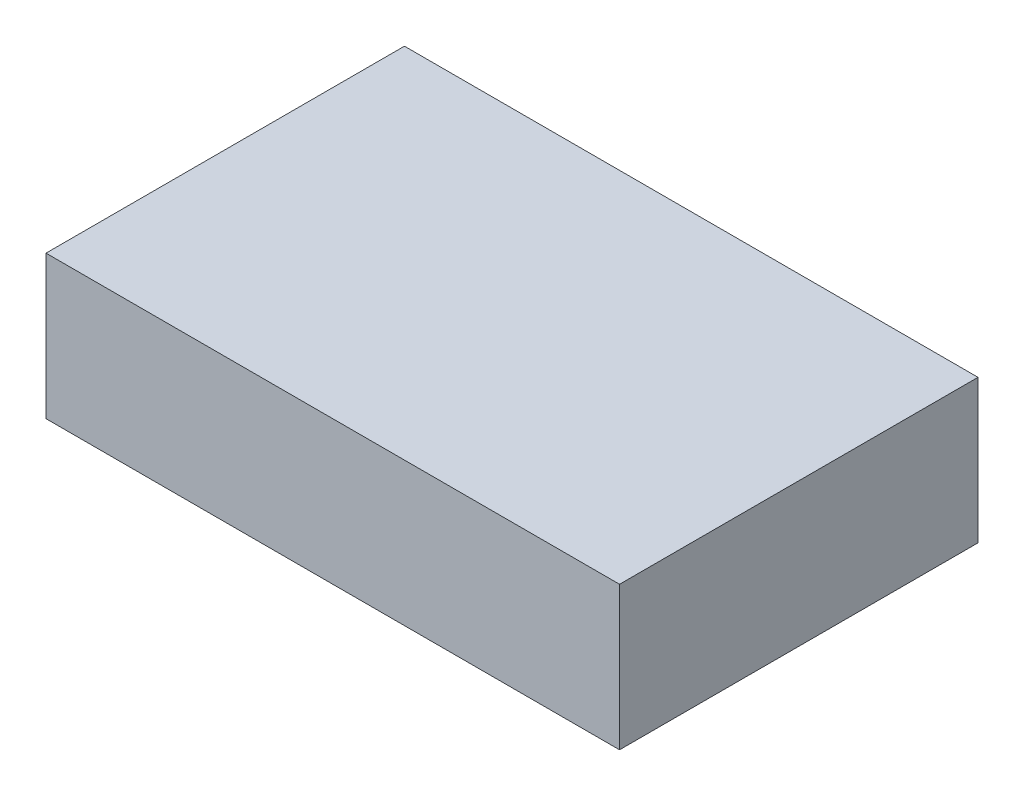
from build123d import *

# Parameters (mm, degrees)
SKETCH_1_W      = 80
SKETCH_1_H      = 50
EXTRUDE_1_DEPTH = 20


with BuildPart() as part:
    # 草图1 → 凸台-拉伸1 (new body)
    with BuildSketch(Plane(origin=(0, 0, 0), x_dir=(1, 0, 0), z_dir=(0, 1, 0))):
        with Locations((40, -25)):
            Rectangle(SKETCH_1_W, SKETCH_1_H)
    extrude(amount=EXTRUDE_1_DEPTH)


solid = part.part
